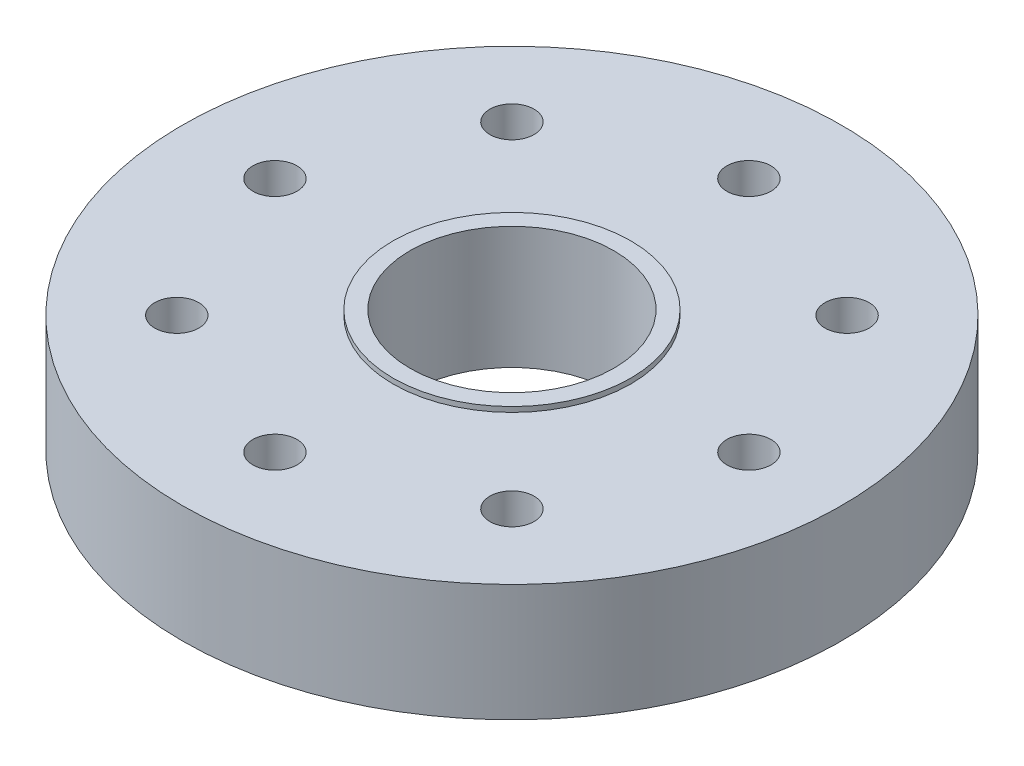
from build123d import *

# Parameters (mm, degrees)
SKETCH1_R               = 9.7
BOSS_EXTRUDE1_DEPTH     = 3.6
CUT_EXTRUDE1_DEPTH      = 15.182383439
CUT_EXTRUDE1_DEPTH_BACK = 15.182383439
SKETCH2_R               = 0.65
CUT_EXTRUDE2_DEPTH      = 15.182383439
CUT_EXTRUDE2_DEPTH_BACK = 15.182383439
SKETCH3_R               = 3
SKETCH4_R               = 9.7
SKETCH4_R_2             = 3.5
SKETCH4_R_3             = 0.65
CUT_EXTRUDE3_DEPTH      = 0.15


with BuildPart() as part:
    # Sketch1 → Boss-Extrude1 (new body)
    with BuildSketch(Plane(origin=(0, 0, 0), x_dir=(1, 0, 0), z_dir=(0, 1, 0))):
        with Locations(Location((0, 0, 0), (0, 0, 270))):
            Circle(SKETCH1_R)
    extrude(amount=BOSS_EXTRUDE1_DEPTH)

    # Sketch2 → Cut-Extrude1 (cut, two sides: drawn at the far end of the back side and taken through both)
    with BuildSketch(Plane(origin=(0, 3.6, 0), x_dir=(1, 0, 0), z_dir=(0, 1, 0)).offset(-CUT_EXTRUDE1_DEPTH_BACK)):
        with Locations(Location((-6.975, 0, 0), (0, 0, 270))):
            Circle(SKETCH2_R)
        with Locations(Location((-4.932069799, 4.932069799, 0), (0, 0, 270))):
            Circle(SKETCH2_R)
        with Locations(Location((0, 6.975, 0), (0, 0, 270))):
            Circle(SKETCH2_R)
        with Locations(Location((4.932069799, 4.932069799, 0), (0, 0, 270))):
            Circle(SKETCH2_R)
        with Locations(Location((6.975, 0, 0), (0, 0, 270))):
            Circle(SKETCH2_R)
        with Locations(Location((4.932069799, -4.932069799, 0), (0, 0, 270))):
            Circle(SKETCH2_R)
        with Locations(Location((0, -6.975, 0), (0, 0, 270))):
            Circle(SKETCH2_R)
        with Locations(Location((-4.932069799, -4.932069799, 0), (0, 0, 270))):
            Circle(SKETCH2_R)
    extrude(amount=CUT_EXTRUDE1_DEPTH + CUT_EXTRUDE1_DEPTH_BACK, mode=Mode.SUBTRACT)

    # Sketch3 → Cut-Extrude2 (cut, two sides: drawn at the far end of the back side and taken through both)
    with BuildSketch(Plane(origin=(0, 3.6, 0), x_dir=(1, 0, 0), z_dir=(0, 1, 0)).offset(-CUT_EXTRUDE2_DEPTH_BACK)):
        with Locations(Location((0, 0, 0), (0, 0, 270))):
            Circle(SKETCH3_R)
    extrude(amount=CUT_EXTRUDE2_DEPTH + CUT_EXTRUDE2_DEPTH_BACK, mode=Mode.SUBTRACT)

    # Sketch4 → Cut-Extrude3 (cut)
    with BuildSketch(Plane(origin=(0, 3.6, 0), x_dir=(1, 0, 0), z_dir=(0, 1, 0))):
        with Locations(Location((0, 0, 0), (0, 0, 270))):
            Circle(SKETCH4_R)
        with Locations(Location((0, 0, 0), (0, 0, 270))):
            Circle(SKETCH4_R_2, mode=Mode.SUBTRACT)
        with Locations(Location((-6.975, 0, 0), (0, 0, 270))):
            Circle(SKETCH4_R_3, mode=Mode.SUBTRACT)
        with Locations(Location((0, 6.975, 0), (0, 0, 270))):
            Circle(SKETCH4_R_3, mode=Mode.SUBTRACT)
        with Locations(Location((6.975, 0, 0), (0, 0, 270))):
            Circle(SKETCH4_R_3, mode=Mode.SUBTRACT)
        with Locations(Location((0, -6.975, 0), (0, 0, 270))):
            Circle(SKETCH4_R_3, mode=Mode.SUBTRACT)
        with Locations(Location((-4.932069799, -4.932069799, 0), (0, 0, 270))):
            Circle(SKETCH4_R_3, mode=Mode.SUBTRACT)
        with Locations(Location((4.932069799, -4.932069799, 0), (0, 0, 270))):
            Circle(SKETCH4_R_3, mode=Mode.SUBTRACT)
        with Locations(Location((4.932069799, 4.932069799, 0), (0, 0, 270))):
            Circle(SKETCH4_R_3, mode=Mode.SUBTRACT)
        with Locations(Location((-4.932069799, 4.932069799, 0), (0, 0, 270))):
            Circle(SKETCH4_R_3, mode=Mode.SUBTRACT)
    extrude(amount=-CUT_EXTRUDE3_DEPTH, mode=Mode.SUBTRACT)


solid = part.part
